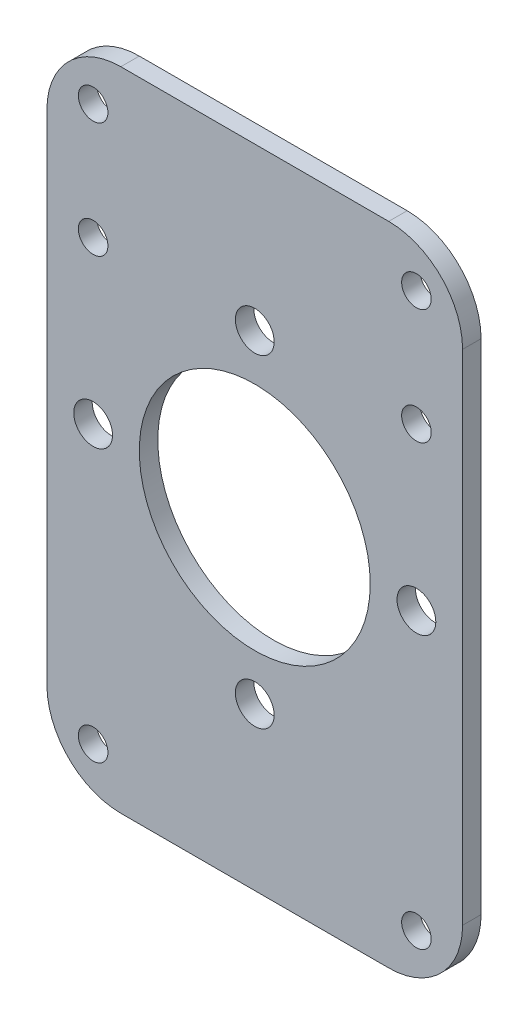
from build123d import *

# Parameters (mm, degrees)
SKETCH_1_W      = 45
SKETCH_1_H      = 70
SKETCH_1_R      = 2.1
SKETCH_1_R_2    = 12.5
SKETCH_1_R_3    = 1.6
EXTRUDE_1_DEPTH = 2
FILLET_1_R      = 8


with BuildPart() as part:
    # ｽｹｯﾁ1 → ﾎﾞｽ - 押し出し1 (new body)
    with BuildSketch(Plane.XY):
        Rectangle(SKETCH_1_W, SKETCH_1_H)
        with Locations((-17.5, 0)):
            Circle(SKETCH_1_R, mode=Mode.SUBTRACT)
        with Locations((0, 17.5)):
            Circle(SKETCH_1_R, mode=Mode.SUBTRACT)
        with Locations((17.5, 0)):
            Circle(SKETCH_1_R, mode=Mode.SUBTRACT)
        with Locations((0, -17.5)):
            Circle(SKETCH_1_R, mode=Mode.SUBTRACT)
        Circle(SKETCH_1_R_2, mode=Mode.SUBTRACT)
        with Locations((-17.5, 30)):
            Circle(SKETCH_1_R_3, mode=Mode.SUBTRACT)
        with Locations((17.5, 30)):
            Circle(SKETCH_1_R_3, mode=Mode.SUBTRACT)
        with Locations((-17.5, -30)):
            Circle(SKETCH_1_R_3, mode=Mode.SUBTRACT)
        with Locations((17.5, -30)):
            Circle(SKETCH_1_R_3, mode=Mode.SUBTRACT)
        with Locations((-17.5, 17.5)):
            Circle(SKETCH_1_R_3, mode=Mode.SUBTRACT)
        with Locations((17.5, 17.5)):
            Circle(SKETCH_1_R_3, mode=Mode.SUBTRACT)
    extrude(amount=EXTRUDE_1_DEPTH)

    # ﾌｨﾚｯﾄ1
    fillet_1_edges = [part.edges().sort_by_distance(p)[0] for p in [
        (-22.5, 35, 1),
        (22.5, 35, 1),
        (22.5, -35, 1),
        (-22.5, -35, 1),
    ]]
    fillet(fillet_1_edges, radius=FILLET_1_R)


solid = part.part
